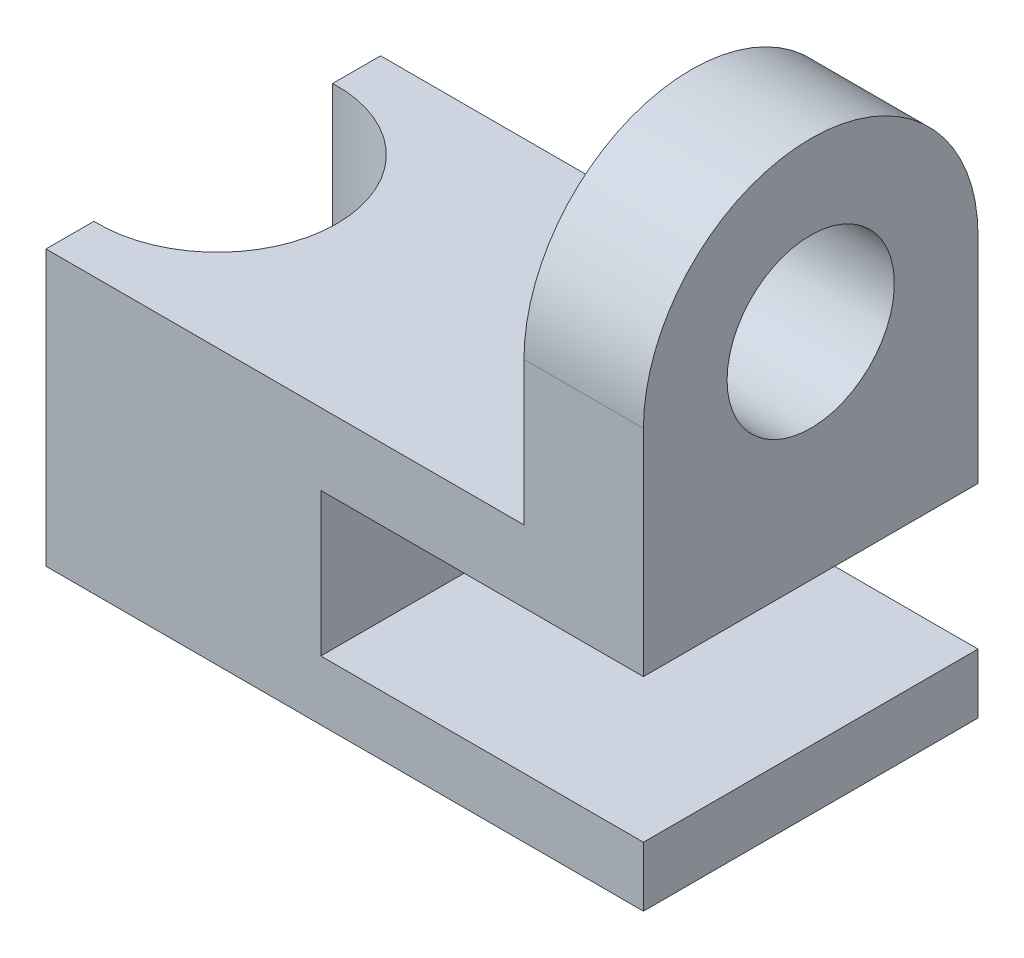
from build123d import *

# Parameters (mm, degrees)
BOSS_EXTRUDE1_DEPTH = 28000
CUT_EXTRUDE1_DEPTH  = 61750.493925052
BOSS_EXTRUDE2_DEPTH = 10000
CUT_EXTRUDE2_DEPTH  = 65727.70690062


with BuildPart() as part:
    # Sketch1 → Boss-Extrude1 (new body)
    with BuildSketch(Plane.XY):
        Polygon((0, 0), (0, -5000), (-50000, -5000), (-50000, 18000), (-10000, 18000), (-10000, 30000), (0, 30000), (0, 12000), (-27000, 12000), (-27000, 0), align=None)
    extrude(amount=BOSS_EXTRUDE1_DEPTH)

    # Sketch2 → Cut-Extrude1 (cut, through all)
    with BuildSketch(Plane(origin=(0, 18000, 0), x_dir=(1, 0, 0), z_dir=(0, 1, 0))):
        with BuildLine():
            Line((-50000, -4005.794630132), (-50000, -23994.205369868))
            ThreePointArc((-50000, -23994.205369868), (-39659.619294178, -14000), (-50000, -4005.794630132))
        make_face()
    extrude(amount=-CUT_EXTRUDE1_DEPTH, mode=Mode.SUBTRACT)

    # Sketch3 → Boss-Extrude2 (add, through all)
    with BuildSketch(Plane.ZY.offset(10000)):
        with BuildLine():
            Line((21000, 30000), (28000, 30000))
            ThreePointArc((28000, 30000), (14000, 44000), (0, 30000))
            Line((0, 30000), (7000, 30000))
            ThreePointArc((7000, 30000), (14000, 37000), (21000, 30000))
        make_face()
    extrude(amount=-BOSS_EXTRUDE2_DEPTH)

    # Sketch4 → Cut-Extrude2 (cut, through all)
    with BuildSketch(Plane.ZY.offset(10000)):
        with BuildLine():
            Line((7000, 30000), (21000, 30000))
            ThreePointArc((21000, 30000), (14000, 23000), (7000, 30000))
        make_face()
    extrude(amount=-CUT_EXTRUDE2_DEPTH, mode=Mode.SUBTRACT)


solid = part.part
